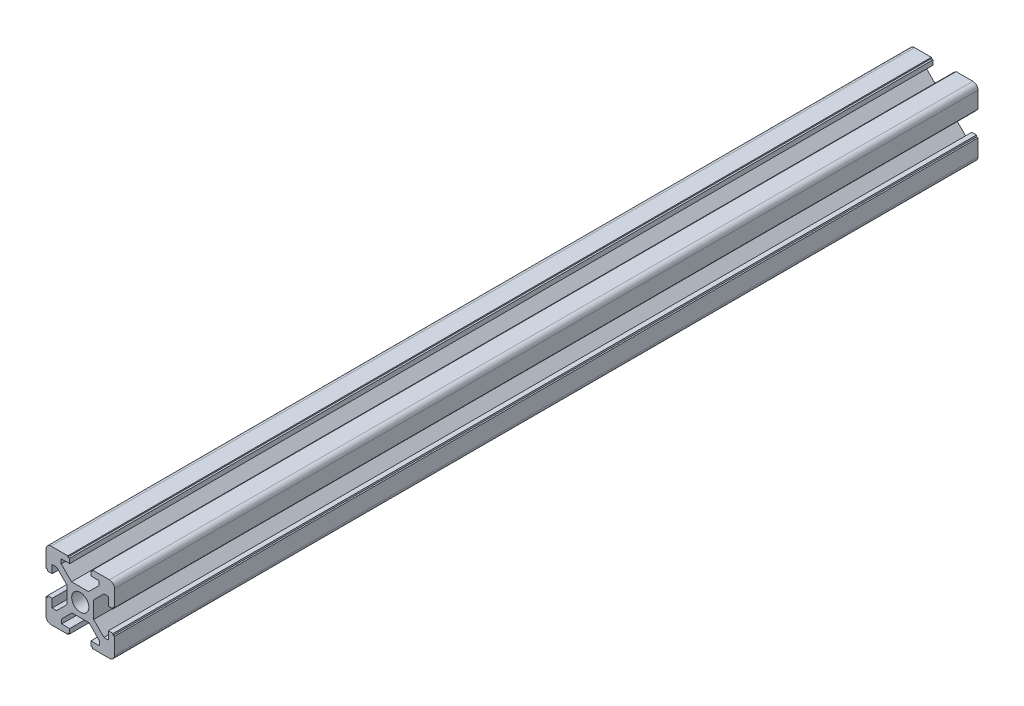
from build123d import *

# Parameters (mm, degrees)
SKETCH1_R           = 2.5
BOSS_EXTRUDE1_DEPTH = 252


with BuildPart() as part:
    # Sketch1 → Boss-Extrude1 (new body)
    with BuildSketch(Plane(origin=(0, 0, 0), x_dir=(-1, 0, 0), z_dir=(0, 0, -1))):
        with BuildLine():
            Line((-31.229112559, 24.389540696), (-31.229112559, 19.574084592))
            Line((-31.229112559, 19.574084592), (-30.801486653, 19.574084592))
            Line((-30.801486653, 19.574084592), (-30.801486653, 19.055371932))
            Line((-30.801486653, 19.055371932), (-29.429112559, 19.055371932))
            Line((-29.429112559, 19.055371932), (-29.429112559, 21.523527696))
            Line((-29.429112559, 21.523527696), (-28.141605593, 21.523527696))
            Line((-28.141605593, 21.523527696), (-25.129112559, 18.511034662))
            Line((-25.129112559, 18.511034662), (-25.129112559, 13.532983276))
            Line((-25.129112559, 13.532983276), (-28.141605593, 10.520490242))
            Line((-28.141605593, 10.520490242), (-29.429112559, 10.520490242))
            Line((-29.429112559, 10.520490242), (-29.429112559, 12.855371932))
            Line((-29.429112559, 12.855371932), (-30.801486653, 12.855371932))
            Line((-30.801486653, 12.855371932), (-30.801486653, 12.350696072))
            Line((-30.801486653, 12.350696072), (-31.229112559, 12.350696072))
            Line((-31.229112559, 12.350696072), (-31.229112559, 7.521203168))
            ThreePointArc((-31.229112559, 7.521203168), (-30.789772731, 6.460542996), (-29.729112559, 6.021203168))
            Line((-29.729112559, 6.021203168), (-24.847825219, 6.021203168))
            Line((-24.847825219, 6.021203168), (-24.847825219, 6.382997838))
            Line((-24.847825219, 6.382997838), (-24.329112559, 6.382997838))
            Line((-24.329112559, 6.382997838), (-24.329112559, 7.755371932))
            Line((-24.329112559, 7.755371932), (-26.797268323, 7.755371932))
            Line((-26.797268323, 7.755371932), (-26.797268323, 9.042878898))
            Line((-26.797268323, 9.042878898), (-23.784775289, 12.055371932))
            Line((-23.784775289, 12.055371932), (-18.806723903, 12.055371932))
            Line((-18.806723903, 12.055371932), (-15.794230869, 9.042878898))
            Line((-15.794230869, 9.042878898), (-15.794230869, 7.755371932))
            Line((-15.794230869, 7.755371932), (-18.129112559, 7.755371932))
            Line((-18.129112559, 7.755371932), (-18.129112559, 6.382997838))
            Line((-18.129112559, 6.382997838), (-17.624436699, 6.382997838))
            Line((-17.624436699, 6.382997838), (-17.624436699, 6.021203168))
            Line((-17.624436699, 6.021203168), (-12.729112559, 6.021203168))
            ThreePointArc((-12.729112559, 6.021203168), (-11.668452387, 6.460542996), (-11.229112559, 7.521203168))
            Line((-11.229112559, 7.521203168), (-11.229112559, 12.336659272))
            Line((-11.229112559, 12.336659272), (-11.656738465, 12.336659272))
            Line((-11.656738465, 12.336659272), (-11.656738465, 12.855371932))
            Line((-11.656738465, 12.855371932), (-13.029112559, 12.855371932))
            Line((-13.029112559, 12.855371932), (-13.029112559, 10.387216168))
            Line((-13.029112559, 10.387216168), (-14.316619525, 10.387216168))
            Line((-14.316619525, 10.387216168), (-17.329112559, 13.399709202))
            Line((-17.329112559, 13.399709202), (-17.329112559, 18.377760588))
            Line((-17.329112559, 18.377760588), (-14.316619525, 21.390253622))
            Line((-14.316619525, 21.390253622), (-13.029112559, 21.390253622))
            Line((-13.029112559, 21.390253622), (-13.029112559, 19.055371932))
            Line((-13.029112559, 19.055371932), (-11.656738465, 19.055371932))
            Line((-11.656738465, 19.055371932), (-11.656738465, 19.560047792))
            Line((-11.656738465, 19.560047792), (-11.229112559, 19.560047792))
            Line((-11.229112559, 19.560047792), (-11.229112559, 24.389540696))
            ThreePointArc((-11.229112559, 24.389540696), (-11.668452387, 25.450200868), (-12.729112559, 25.889540696))
            Line((-12.729112559, 25.889540696), (-17.610399899, 25.889540696))
            Line((-17.610399899, 25.889540696), (-17.610399899, 25.527746026))
            Line((-17.610399899, 25.527746026), (-18.129112559, 25.527746026))
            Line((-18.129112559, 25.527746026), (-18.129112559, 24.155371932))
            Line((-18.129112559, 24.155371932), (-15.660956795, 24.155371932))
            Line((-15.660956795, 24.155371932), (-15.660956795, 22.867864966))
            Line((-15.660956795, 22.867864966), (-18.673449829, 19.855371932))
            Line((-18.673449829, 19.855371932), (-23.651501215, 19.855371932))
            Line((-23.651501215, 19.855371932), (-26.663994249, 22.867864966))
            Line((-26.663994249, 22.867864966), (-26.663994249, 24.155371932))
            Line((-26.663994249, 24.155371932), (-24.329112559, 24.155371932))
            Line((-24.329112559, 24.155371932), (-24.329112559, 25.527746026))
            Line((-24.329112559, 25.527746026), (-24.833788419, 25.527746026))
            Line((-24.833788419, 25.527746026), (-24.833788419, 25.889540696))
            Line((-24.833788419, 25.889540696), (-29.729112559, 25.889540696))
            ThreePointArc((-29.729112559, 25.889540696), (-30.789772731, 25.450200868), (-31.229112559, 24.389540696))
        make_face()
        with Locations(Location((-21.229112559, 15.955371932, 0), (0, 0, 180))):
            Circle(SKETCH1_R, mode=Mode.SUBTRACT)
    extrude(amount=-BOSS_EXTRUDE1_DEPTH)


solid = part.part
